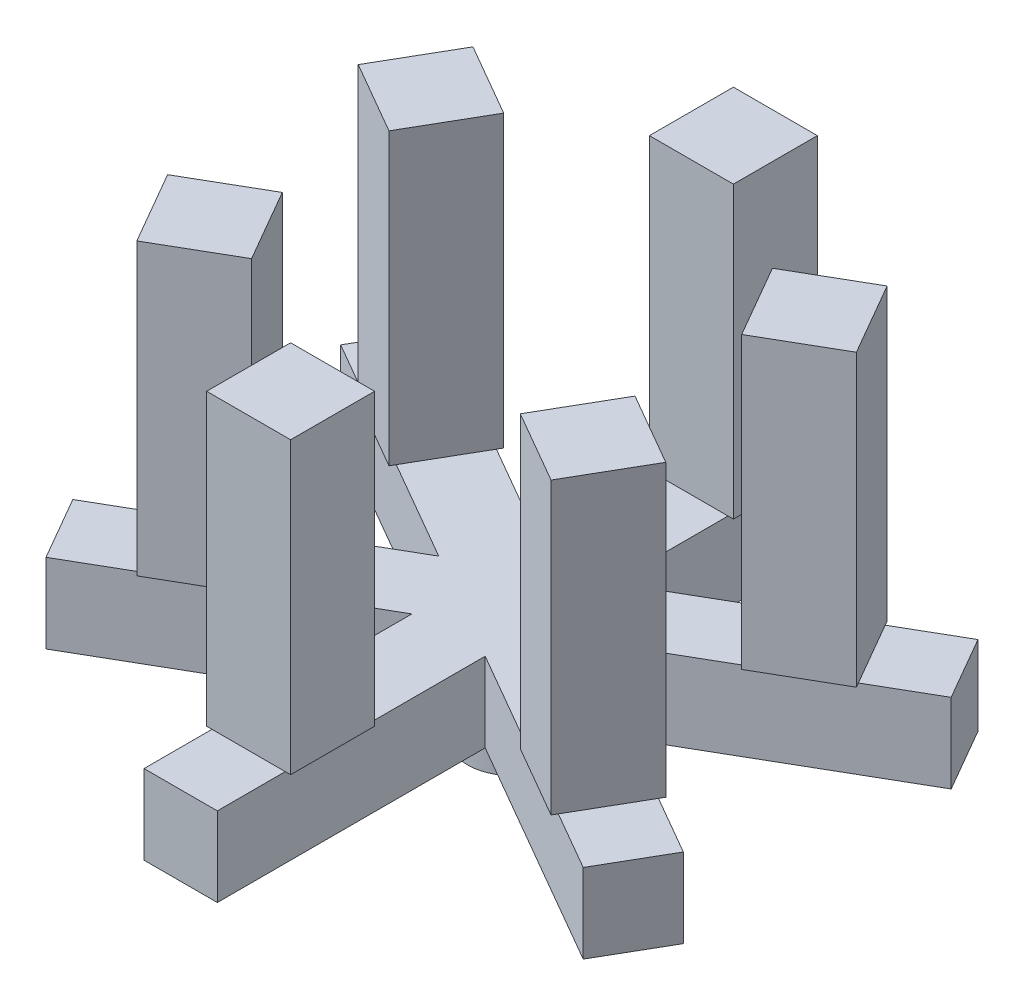
from build123d import *

# Parameters (mm, degrees)
SKETCH1_R           = 29
BOSS_EXTRUDE1_DEPTH = 28
BOSS_EXTRUDE2_DEPTH = 52
SKETCH3_W           = 55
SKETCH3_H           = 55
BOSS_EXTRUDE3_DEPTH = 190
CIRPATTERN1_COUNT   = 6


with BuildPart() as part:
    # Sketch1 → Boss-Extrude1 (new body)
    with BuildSketch(Plane(origin=(0, 0, 0), x_dir=(1, 0, 0), z_dir=(0, 1, 0))):
        Circle(SKETCH1_R)
    extrude(amount=BOSS_EXTRUDE1_DEPTH)

    # Sketch2 → Boss-Extrude2 (add)
    with BuildSketch(Plane(origin=(0, 28, 0), x_dir=(1, 0, 0), z_dir=(0, 1, 0))):
        Polygon((24, 0), (24, 174), (-24, 174), (-24, 0), (-24, -217), (24, -217), align=None)
    boss_extrude2 = extrude(amount=BOSS_EXTRUDE2_DEPTH)

    # Sketch3 → Boss-Extrude3 (add)
    with BuildSketch(Plane(origin=(0, 80, 0), x_dir=(1, 0, 0), z_dir=(0, 1, 0))):
        with Locations((0, -145)):
            Rectangle(SKETCH3_W, SKETCH3_H)
    boss_extrude3 = extrude(amount=BOSS_EXTRUDE3_DEPTH)

    # CirPattern1: Boss-Extrude2, Boss-Extrude3 ×6 about axis
    cirpattern1_axis = Axis((0, 28, 0), (0, -1, 0))
    add([boss_extrude2.rotate(cirpattern1_axis, i * 360 / CIRPATTERN1_COUNT) for i in range(1, CIRPATTERN1_COUNT)])
    add([boss_extrude3.rotate(cirpattern1_axis, i * 360 / CIRPATTERN1_COUNT) for i in range(1, CIRPATTERN1_COUNT)])


solid = part.part
